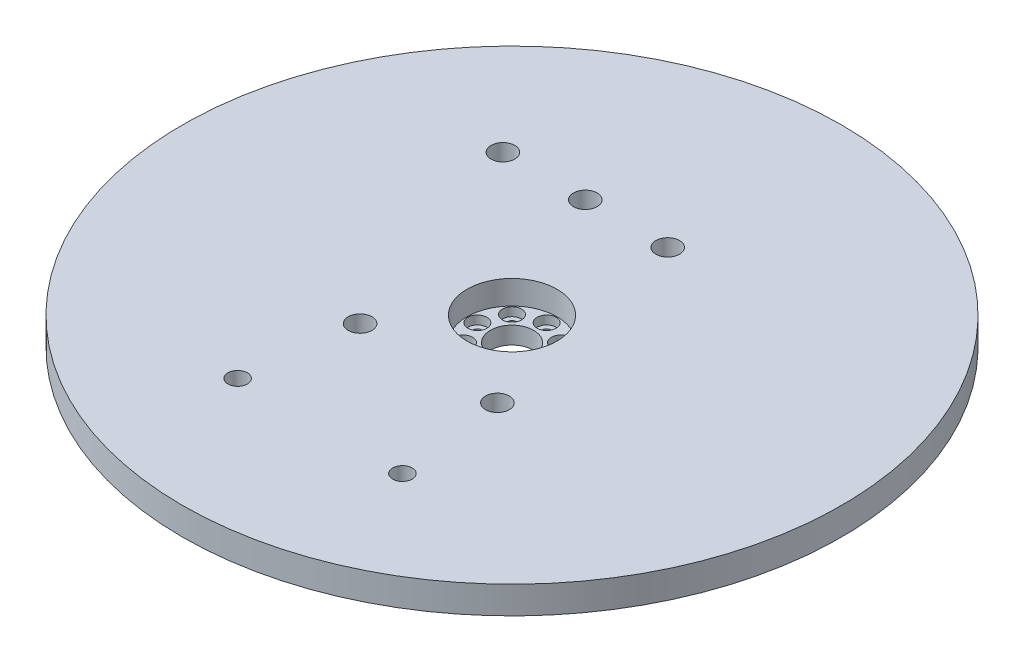
from build123d import *

# Parameters (mm, degrees)
SKETCH1_R                      = 76.2
BOSS_EXTRUDE1_DEPTH            = 3.175
SKETCH2_R                      = 12.065
BOSS_EXTRUDE2_DEPTH            = 3.175
SKETCH5_R                      = 10.4
CUT_EXTRUDE1_DEPTH             = 5.525
SKETCH6_R                      = 5
CUT_EXTRUDE2_DEPTH             = 4
CBORE_FOR_M2_SHCS1_D           = 2.2
CBORE_FOR_M2_SHCS1_DEPTH       = 6
CBORE_FOR_M2_SHCS1_CBORE_D     = 4.4
CBORE_FOR_M2_SHCS1_CBORE_DEPTH = 2
CBORE_FOR_M2_SHCS1_TIP         = 0.660946681
M4_CLEARANCE_HOLE1_D           = 4.5
M5_CLEARANCE_HOLE1_D           = 5.5


with BuildPart() as part:
    # Sketch1 → Boss-Extrude1 (new, symmetric)
    with BuildSketch(Plane(origin=(0, 0, 0), x_dir=(1, 0, 0), z_dir=(0, 1, 0))):
        with Locations(Location((0, 0, 0), (0, 0, 270))):
            Circle(SKETCH1_R)
    extrude(amount=BOSS_EXTRUDE1_DEPTH, both=True)

    # Sketch2 → Boss-Extrude2 (add)
    with BuildSketch(Plane.XZ.offset(3.175)):
        with Locations(Location((0, 0, 0), (0, 0, 270))):
            Circle(SKETCH2_R)
    extrude(amount=BOSS_EXTRUDE2_DEPTH)

    # Sketch5 → Cut-Extrude1 (cut)
    with BuildSketch(Plane(origin=(0, 3.175, 0), x_dir=(1, 0, 0), z_dir=(0, 1, 0))):
        with Locations(Location((0, 0, 0), (0, 0, 270))):
            Circle(SKETCH5_R)
    extrude(amount=-CUT_EXTRUDE1_DEPTH, mode=Mode.SUBTRACT)

    # Sketch6 → Cut-Extrude2 (cut)
    with BuildSketch(Plane(origin=(0, -2.35, 0), x_dir=(1, 0, 0), z_dir=(0, 1, 0))):
        with Locations(Location((0, 0, 0), (0, 0, 270))):
            Circle(SKETCH6_R)
    extrude(amount=-CUT_EXTRUDE2_DEPTH, mode=Mode.SUBTRACT)

    # CBORE for M2 SHCS1
    with Locations(Plane(origin=(0, -2.35, 0), x_dir=(1, 0, 0), z_dir=(0, 1, 0))):
        with Locations((-5.65685425, 5.65685425), (0, 8), (5.65685425, 5.65685425), (8, 0), (5.65685425, -5.65685425), (0, -8), (-5.65685425, -5.65685425), (-8, 0)):
            CounterBoreHole(CBORE_FOR_M2_SHCS1_D / 2, CBORE_FOR_M2_SHCS1_CBORE_D / 2, CBORE_FOR_M2_SHCS1_CBORE_DEPTH, depth=CBORE_FOR_M2_SHCS1_DEPTH)
            with Locations((0, 0, -(CBORE_FOR_M2_SHCS1_DEPTH + CBORE_FOR_M2_SHCS1_TIP / 2))):  # 118° drill point
                Cone(0, CBORE_FOR_M2_SHCS1_D / 2, CBORE_FOR_M2_SHCS1_TIP, mode=Mode.SUBTRACT)

    # M4 Clearance Hole1 (through all)
    with Locations(Plane(origin=(0, 3.175, 0), x_dir=(1, 0, 0), z_dir=(0, 1, 0))):
        with Locations((19.05, -44.388212048), (-19.05, -44.388212048)):
            Hole(M4_CLEARANCE_HOLE1_D / 2)

    # M5 Clearance Hole1 (through all)
    with Locations(Plane(origin=(0, 3.175, 0), x_dir=(1, 0, 0), z_dir=(0, 1, 0))):
        with Locations((-33.6688086, 31.567387952), (-14.6188086, 31.567387952), (4.4311914, 31.567387952), (-15.875, -19.249706448), (15.875, -19.249706448)):
            Hole(M5_CLEARANCE_HOLE1_D / 2)


solid = part.part
